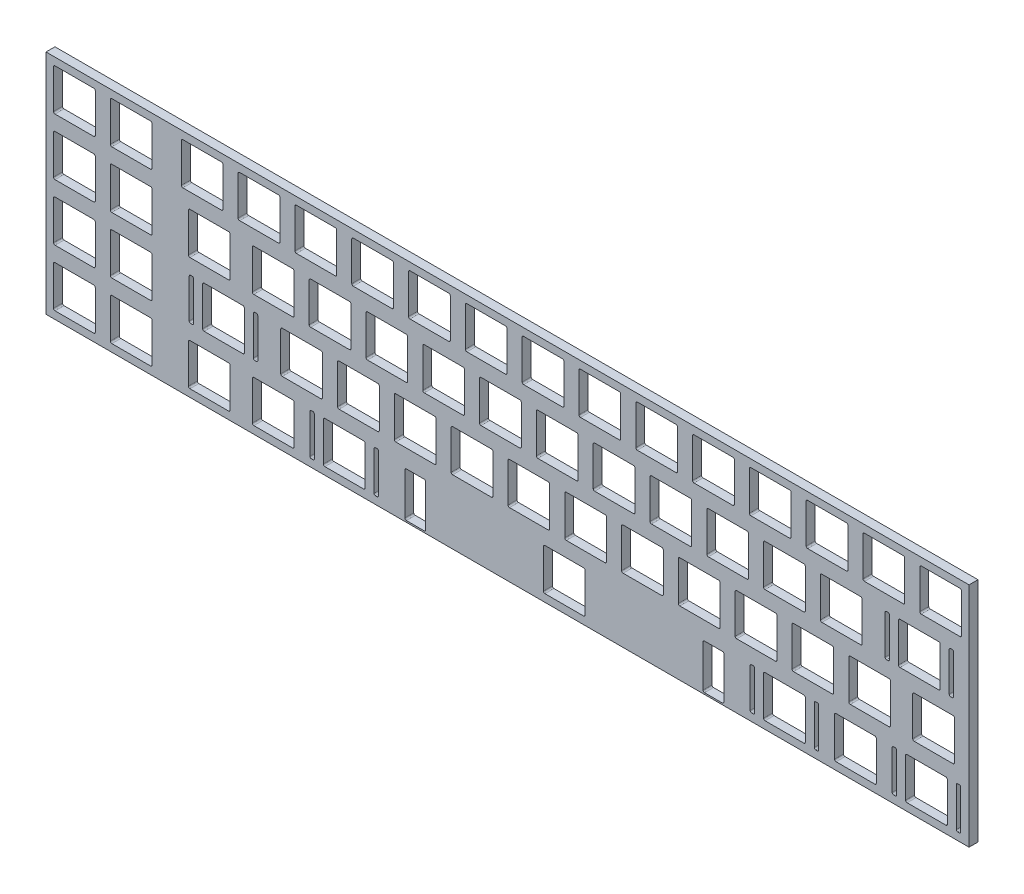
from build123d import *

# Parameters (mm, degrees)
MODEL_W             = 309.5625
MODEL_H             = 76.2
BOSS_EXTRUDE1_DEPTH = 3


with BuildPart() as part:
    # Model → Boss-Extrude1 (new body)
    with BuildSketch(Plane.XY):
        with Locations((154.78125, -38.1)):
            Rectangle(MODEL_W, MODEL_H)
        with BuildLine():
            Line((3.025, -2.525), (16.025, -2.525))
            ThreePointArc((16.025, -2.525), (16.378553391, -2.671446609), (16.525, -3.025))
            Line((16.525, -3.025), (16.525, -16.025))
            ThreePointArc((16.525, -16.025), (16.378553391, -16.378553391), (16.025, -16.525))
            Line((16.025, -16.525), (3.025, -16.525))
            ThreePointArc((3.025, -16.525), (2.671446609, -16.378553391), (2.525, -16.025))
            Line((2.525, -16.025), (2.525, -3.025))
            ThreePointArc((2.525, -3.025), (2.671446609, -2.671446609), (3.025, -2.525))
        make_face(mode=Mode.SUBTRACT)
        with BuildLine():
            Line((22.075, -2.525), (35.075, -2.525))
            ThreePointArc((35.075, -2.525), (35.428553391, -2.671446609), (35.575, -3.025))
            Line((35.575, -3.025), (35.575, -16.025))
            ThreePointArc((35.575, -16.025), (35.428553391, -16.378553391), (35.075, -16.525))
            Line((35.075, -16.525), (22.075, -16.525))
            ThreePointArc((22.075, -16.525), (21.721446609, -16.378553391), (21.575, -16.025))
            Line((21.575, -16.025), (21.575, -3.025))
            ThreePointArc((21.575, -3.025), (21.721446609, -2.671446609), (22.075, -2.525))
        make_face(mode=Mode.SUBTRACT)
        with BuildLine():
            Line((45.8875, -2.525), (58.8875, -2.525))
            ThreePointArc((58.8875, -2.525), (59.241053391, -2.671446609), (59.3875, -3.025))
            Line((59.3875, -3.025), (59.3875, -16.025))
            ThreePointArc((59.3875, -16.025), (59.241053391, -16.378553391), (58.8875, -16.525))
            Line((58.8875, -16.525), (45.8875, -16.525))
            ThreePointArc((45.8875, -16.525), (45.533946609, -16.378553391), (45.3875, -16.025))
            Line((45.3875, -16.025), (45.3875, -3.025))
            ThreePointArc((45.3875, -3.025), (45.533946609, -2.671446609), (45.8875, -2.525))
        make_face(mode=Mode.SUBTRACT)
        with BuildLine():
            Line((64.9375, -2.525), (77.9375, -2.525))
            ThreePointArc((77.9375, -2.525), (78.291053391, -2.671446609), (78.4375, -3.025))
            Line((78.4375, -3.025), (78.4375, -16.025))
            ThreePointArc((78.4375, -16.025), (78.291053391, -16.378553391), (77.9375, -16.525))
            Line((77.9375, -16.525), (64.9375, -16.525))
            ThreePointArc((64.9375, -16.525), (64.583946609, -16.378553391), (64.4375, -16.025))
            Line((64.4375, -16.025), (64.4375, -3.025))
            ThreePointArc((64.4375, -3.025), (64.583946609, -2.671446609), (64.9375, -2.525))
        make_face(mode=Mode.SUBTRACT)
        with BuildLine():
            Line((83.9875, -2.525), (96.9875, -2.525))
            ThreePointArc((96.9875, -2.525), (97.341053391, -2.671446609), (97.4875, -3.025))
            Line((97.4875, -3.025), (97.4875, -16.025))
            ThreePointArc((97.4875, -16.025), (97.341053391, -16.378553391), (96.9875, -16.525))
            Line((96.9875, -16.525), (83.9875, -16.525))
            ThreePointArc((83.9875, -16.525), (83.633946609, -16.378553391), (83.4875, -16.025))
            Line((83.4875, -16.025), (83.4875, -3.025))
            ThreePointArc((83.4875, -3.025), (83.633946609, -2.671446609), (83.9875, -2.525))
        make_face(mode=Mode.SUBTRACT)
        with BuildLine():
            Line((103.0375, -2.525), (116.0375, -2.525))
            ThreePointArc((116.0375, -2.525), (116.391053391, -2.671446609), (116.5375, -3.025))
            Line((116.5375, -3.025), (116.5375, -16.025))
            ThreePointArc((116.5375, -16.025), (116.391053391, -16.378553391), (116.0375, -16.525))
            Line((116.0375, -16.525), (103.0375, -16.525))
            ThreePointArc((103.0375, -16.525), (102.683946609, -16.378553391), (102.5375, -16.025))
            Line((102.5375, -16.025), (102.5375, -3.025))
            ThreePointArc((102.5375, -3.025), (102.683946609, -2.671446609), (103.0375, -2.525))
        make_face(mode=Mode.SUBTRACT)
        with BuildLine():
            Line((122.0875, -2.525), (135.0875, -2.525))
            ThreePointArc((135.0875, -2.525), (135.441053391, -2.671446609), (135.5875, -3.025))
            Line((135.5875, -3.025), (135.5875, -16.025))
            ThreePointArc((135.5875, -16.025), (135.441053391, -16.378553391), (135.0875, -16.525))
            Line((135.0875, -16.525), (122.0875, -16.525))
            ThreePointArc((122.0875, -16.525), (121.733946609, -16.378553391), (121.5875, -16.025))
            Line((121.5875, -16.025), (121.5875, -3.025))
            ThreePointArc((121.5875, -3.025), (121.733946609, -2.671446609), (122.0875, -2.525))
        make_face(mode=Mode.SUBTRACT)
        with BuildLine():
            Line((141.1375, -2.525), (154.1375, -2.525))
            ThreePointArc((154.1375, -2.525), (154.491053391, -2.671446609), (154.6375, -3.025))
            Line((154.6375, -3.025), (154.6375, -16.025))
            ThreePointArc((154.6375, -16.025), (154.491053391, -16.378553391), (154.1375, -16.525))
            Line((154.1375, -16.525), (141.1375, -16.525))
            ThreePointArc((141.1375, -16.525), (140.783946609, -16.378553391), (140.6375, -16.025))
            Line((140.6375, -16.025), (140.6375, -3.025))
            ThreePointArc((140.6375, -3.025), (140.783946609, -2.671446609), (141.1375, -2.525))
        make_face(mode=Mode.SUBTRACT)
        with BuildLine():
            Line((160.1875, -2.525), (173.1875, -2.525))
            ThreePointArc((173.1875, -2.525), (173.541053391, -2.671446609), (173.6875, -3.025))
            Line((173.6875, -3.025), (173.6875, -16.025))
            ThreePointArc((173.6875, -16.025), (173.541053391, -16.378553391), (173.1875, -16.525))
            Line((173.1875, -16.525), (160.1875, -16.525))
            ThreePointArc((160.1875, -16.525), (159.833946609, -16.378553391), (159.6875, -16.025))
            Line((159.6875, -16.025), (159.6875, -3.025))
            ThreePointArc((159.6875, -3.025), (159.833946609, -2.671446609), (160.1875, -2.525))
        make_face(mode=Mode.SUBTRACT)
        with BuildLine():
            Line((179.2375, -2.525), (192.2375, -2.525))
            ThreePointArc((192.2375, -2.525), (192.591053391, -2.671446609), (192.7375, -3.025))
            Line((192.7375, -3.025), (192.7375, -16.025))
            ThreePointArc((192.7375, -16.025), (192.591053391, -16.378553391), (192.2375, -16.525))
            Line((192.2375, -16.525), (179.2375, -16.525))
            ThreePointArc((179.2375, -16.525), (178.883946609, -16.378553391), (178.7375, -16.025))
            Line((178.7375, -16.025), (178.7375, -3.025))
            ThreePointArc((178.7375, -3.025), (178.883946609, -2.671446609), (179.2375, -2.525))
        make_face(mode=Mode.SUBTRACT)
        with BuildLine():
            Line((198.2875, -2.525), (211.2875, -2.525))
            ThreePointArc((211.2875, -2.525), (211.641053391, -2.671446609), (211.7875, -3.025))
            Line((211.7875, -3.025), (211.7875, -16.025))
            ThreePointArc((211.7875, -16.025), (211.641053391, -16.378553391), (211.2875, -16.525))
            Line((211.2875, -16.525), (198.2875, -16.525))
            ThreePointArc((198.2875, -16.525), (197.933946609, -16.378553391), (197.7875, -16.025))
            Line((197.7875, -16.025), (197.7875, -3.025))
            ThreePointArc((197.7875, -3.025), (197.933946609, -2.671446609), (198.2875, -2.525))
        make_face(mode=Mode.SUBTRACT)
        with BuildLine():
            Line((217.3375, -2.525), (230.3375, -2.525))
            ThreePointArc((230.3375, -2.525), (230.691053391, -2.671446609), (230.8375, -3.025))
            Line((230.8375, -3.025), (230.8375, -16.025))
            ThreePointArc((230.8375, -16.025), (230.691053391, -16.378553391), (230.3375, -16.525))
            Line((230.3375, -16.525), (217.3375, -16.525))
            ThreePointArc((217.3375, -16.525), (216.983946609, -16.378553391), (216.8375, -16.025))
            Line((216.8375, -16.025), (216.8375, -3.025))
            ThreePointArc((216.8375, -3.025), (216.983946609, -2.671446609), (217.3375, -2.525))
        make_face(mode=Mode.SUBTRACT)
        with BuildLine():
            Line((236.3875, -2.525), (249.3875, -2.525))
            ThreePointArc((249.3875, -2.525), (249.741053391, -2.671446609), (249.8875, -3.025))
            Line((249.8875, -3.025), (249.8875, -16.025))
            ThreePointArc((249.8875, -16.025), (249.741053391, -16.378553391), (249.3875, -16.525))
            Line((249.3875, -16.525), (236.3875, -16.525))
            ThreePointArc((236.3875, -16.525), (236.033946609, -16.378553391), (235.8875, -16.025))
            Line((235.8875, -16.025), (235.8875, -3.025))
            ThreePointArc((235.8875, -3.025), (236.033946609, -2.671446609), (236.3875, -2.525))
        make_face(mode=Mode.SUBTRACT)
        with BuildLine():
            Line((255.4375, -2.525), (268.4375, -2.525))
            ThreePointArc((268.4375, -2.525), (268.791053391, -2.671446609), (268.9375, -3.025))
            Line((268.9375, -3.025), (268.9375, -16.025))
            ThreePointArc((268.9375, -16.025), (268.791053391, -16.378553391), (268.4375, -16.525))
            Line((268.4375, -16.525), (255.4375, -16.525))
            ThreePointArc((255.4375, -16.525), (255.083946609, -16.378553391), (254.9375, -16.025))
            Line((254.9375, -16.025), (254.9375, -3.025))
            ThreePointArc((254.9375, -3.025), (255.083946609, -2.671446609), (255.4375, -2.525))
        make_face(mode=Mode.SUBTRACT)
        with BuildLine():
            Line((274.4875, -2.525), (287.4875, -2.525))
            ThreePointArc((287.4875, -2.525), (287.841053391, -2.671446609), (287.9875, -3.025))
            Line((287.9875, -3.025), (287.9875, -16.025))
            ThreePointArc((287.9875, -16.025), (287.841053391, -16.378553391), (287.4875, -16.525))
            Line((287.4875, -16.525), (274.4875, -16.525))
            ThreePointArc((274.4875, -16.525), (274.133946609, -16.378553391), (273.9875, -16.025))
            Line((273.9875, -16.025), (273.9875, -3.025))
            ThreePointArc((273.9875, -3.025), (274.133946609, -2.671446609), (274.4875, -2.525))
        make_face(mode=Mode.SUBTRACT)
        with BuildLine():
            Line((293.5375, -2.525), (306.5375, -2.525))
            ThreePointArc((306.5375, -2.525), (306.891053391, -2.671446609), (307.0375, -3.025))
            Line((307.0375, -3.025), (307.0375, -16.025))
            ThreePointArc((307.0375, -16.025), (306.891053391, -16.378553391), (306.5375, -16.525))
            Line((306.5375, -16.525), (293.5375, -16.525))
            ThreePointArc((293.5375, -16.525), (293.183946609, -16.378553391), (293.0375, -16.025))
            Line((293.0375, -16.025), (293.0375, -3.025))
            ThreePointArc((293.0375, -3.025), (293.183946609, -2.671446609), (293.5375, -2.525))
        make_face(mode=Mode.SUBTRACT)
        with BuildLine():
            Line((3.025, -21.575), (16.025, -21.575))
            ThreePointArc((16.025, -21.575), (16.378553391, -21.721446609), (16.525, -22.075))
            Line((16.525, -22.075), (16.525, -35.075))
            ThreePointArc((16.525, -35.075), (16.378553391, -35.428553391), (16.025, -35.575))
            Line((16.025, -35.575), (3.025, -35.575))
            ThreePointArc((3.025, -35.575), (2.671446609, -35.428553391), (2.525, -35.075))
            Line((2.525, -35.075), (2.525, -22.075))
            ThreePointArc((2.525, -22.075), (2.671446609, -21.721446609), (3.025, -21.575))
        make_face(mode=Mode.SUBTRACT)
        with BuildLine():
            Line((22.075, -21.575), (35.075, -21.575))
            ThreePointArc((35.075, -21.575), (35.428553391, -21.721446609), (35.575, -22.075))
            Line((35.575, -22.075), (35.575, -35.075))
            ThreePointArc((35.575, -35.075), (35.428553391, -35.428553391), (35.075, -35.575))
            Line((35.075, -35.575), (22.075, -35.575))
            ThreePointArc((22.075, -35.575), (21.721446609, -35.428553391), (21.575, -35.075))
            Line((21.575, -35.075), (21.575, -22.075))
            ThreePointArc((21.575, -22.075), (21.721446609, -21.721446609), (22.075, -21.575))
        make_face(mode=Mode.SUBTRACT)
        with BuildLine():
            Line((48.26875, -21.575), (61.26875, -21.575))
            ThreePointArc((61.26875, -21.575), (61.622303391, -21.721446609), (61.76875, -22.075))
            Line((61.76875, -22.075), (61.76875, -35.075))
            ThreePointArc((61.76875, -35.075), (61.622303391, -35.428553391), (61.26875, -35.575))
            Line((61.26875, -35.575), (48.26875, -35.575))
            ThreePointArc((48.26875, -35.575), (47.915196609, -35.428553391), (47.76875, -35.075))
            Line((47.76875, -35.075), (47.76875, -22.075))
            ThreePointArc((47.76875, -22.075), (47.915196609, -21.721446609), (48.26875, -21.575))
        make_face(mode=Mode.SUBTRACT)
        with BuildLine():
            Line((69.7, -21.575), (82.7, -21.575))
            ThreePointArc((82.7, -21.575), (83.053553391, -21.721446609), (83.2, -22.075))
            Line((83.2, -22.075), (83.2, -35.075))
            ThreePointArc((83.2, -35.075), (83.053553391, -35.428553391), (82.7, -35.575))
            Line((82.7, -35.575), (69.7, -35.575))
            ThreePointArc((69.7, -35.575), (69.346446609, -35.428553391), (69.2, -35.075))
            Line((69.2, -35.075), (69.2, -22.075))
            ThreePointArc((69.2, -22.075), (69.346446609, -21.721446609), (69.7, -21.575))
        make_face(mode=Mode.SUBTRACT)
        with BuildLine():
            Line((88.75, -21.575), (101.75, -21.575))
            ThreePointArc((101.75, -21.575), (102.103553391, -21.721446609), (102.25, -22.075))
            Line((102.25, -22.075), (102.25, -35.075))
            ThreePointArc((102.25, -35.075), (102.103553391, -35.428553391), (101.75, -35.575))
            Line((101.75, -35.575), (88.75, -35.575))
            ThreePointArc((88.75, -35.575), (88.396446609, -35.428553391), (88.25, -35.075))
            Line((88.25, -35.075), (88.25, -22.075))
            ThreePointArc((88.25, -22.075), (88.396446609, -21.721446609), (88.75, -21.575))
        make_face(mode=Mode.SUBTRACT)
        with BuildLine():
            Line((107.8, -21.575), (120.8, -21.575))
            ThreePointArc((120.8, -21.575), (121.153553391, -21.721446609), (121.3, -22.075))
            Line((121.3, -22.075), (121.3, -35.075))
            ThreePointArc((121.3, -35.075), (121.153553391, -35.428553391), (120.8, -35.575))
            Line((120.8, -35.575), (107.8, -35.575))
            ThreePointArc((107.8, -35.575), (107.446446609, -35.428553391), (107.3, -35.075))
            Line((107.3, -35.075), (107.3, -22.075))
            ThreePointArc((107.3, -22.075), (107.446446609, -21.721446609), (107.8, -21.575))
        make_face(mode=Mode.SUBTRACT)
        with BuildLine():
            Line((126.85, -21.575), (139.85, -21.575))
            ThreePointArc((139.85, -21.575), (140.203553391, -21.721446609), (140.35, -22.075))
            Line((140.35, -22.075), (140.35, -35.075))
            ThreePointArc((140.35, -35.075), (140.203553391, -35.428553391), (139.85, -35.575))
            Line((139.85, -35.575), (126.85, -35.575))
            ThreePointArc((126.85, -35.575), (126.496446609, -35.428553391), (126.35, -35.075))
            Line((126.35, -35.075), (126.35, -22.075))
            ThreePointArc((126.35, -22.075), (126.496446609, -21.721446609), (126.85, -21.575))
        make_face(mode=Mode.SUBTRACT)
        with BuildLine():
            Line((145.9, -21.575), (158.9, -21.575))
            ThreePointArc((158.9, -21.575), (159.253553391, -21.721446609), (159.4, -22.075))
            Line((159.4, -22.075), (159.4, -35.075))
            ThreePointArc((159.4, -35.075), (159.253553391, -35.428553391), (158.9, -35.575))
            Line((158.9, -35.575), (145.9, -35.575))
            ThreePointArc((145.9, -35.575), (145.546446609, -35.428553391), (145.4, -35.075))
            Line((145.4, -35.075), (145.4, -22.075))
            ThreePointArc((145.4, -22.075), (145.546446609, -21.721446609), (145.9, -21.575))
        make_face(mode=Mode.SUBTRACT)
        with BuildLine():
            Line((164.95, -21.575), (177.95, -21.575))
            ThreePointArc((177.95, -21.575), (178.303553391, -21.721446609), (178.45, -22.075))
            Line((178.45, -22.075), (178.45, -35.075))
            ThreePointArc((178.45, -35.075), (178.303553391, -35.428553391), (177.95, -35.575))
            Line((177.95, -35.575), (164.95, -35.575))
            ThreePointArc((164.95, -35.575), (164.596446609, -35.428553391), (164.45, -35.075))
            Line((164.45, -35.075), (164.45, -22.075))
            ThreePointArc((164.45, -22.075), (164.596446609, -21.721446609), (164.95, -21.575))
        make_face(mode=Mode.SUBTRACT)
        with BuildLine():
            Line((184, -21.575), (197, -21.575))
            ThreePointArc((197, -21.575), (197.353553391, -21.721446609), (197.5, -22.075))
            Line((197.5, -22.075), (197.5, -35.075))
            ThreePointArc((197.5, -35.075), (197.353553391, -35.428553391), (197, -35.575))
            Line((197, -35.575), (184, -35.575))
            ThreePointArc((184, -35.575), (183.646446609, -35.428553391), (183.5, -35.075))
            Line((183.5, -35.075), (183.5, -22.075))
            ThreePointArc((183.5, -22.075), (183.646446609, -21.721446609), (184, -21.575))
        make_face(mode=Mode.SUBTRACT)
        with BuildLine():
            Line((203.05, -21.575), (216.05, -21.575))
            ThreePointArc((216.05, -21.575), (216.403553391, -21.721446609), (216.55, -22.075))
            Line((216.55, -22.075), (216.55, -35.075))
            ThreePointArc((216.55, -35.075), (216.403553391, -35.428553391), (216.05, -35.575))
            Line((216.05, -35.575), (203.05, -35.575))
            ThreePointArc((203.05, -35.575), (202.696446609, -35.428553391), (202.55, -35.075))
            Line((202.55, -35.075), (202.55, -22.075))
            ThreePointArc((202.55, -22.075), (202.696446609, -21.721446609), (203.05, -21.575))
        make_face(mode=Mode.SUBTRACT)
        with BuildLine():
            Line((222.1, -21.575), (235.1, -21.575))
            ThreePointArc((235.1, -21.575), (235.453553391, -21.721446609), (235.6, -22.075))
            Line((235.6, -22.075), (235.6, -35.075))
            ThreePointArc((235.6, -35.075), (235.453553391, -35.428553391), (235.1, -35.575))
            Line((235.1, -35.575), (222.1, -35.575))
            ThreePointArc((222.1, -35.575), (221.746446609, -35.428553391), (221.6, -35.075))
            Line((221.6, -35.075), (221.6, -22.075))
            ThreePointArc((221.6, -22.075), (221.746446609, -21.721446609), (222.1, -21.575))
        make_face(mode=Mode.SUBTRACT)
        with BuildLine():
            Line((241.15, -21.575), (254.15, -21.575))
            ThreePointArc((254.15, -21.575), (254.503553391, -21.721446609), (254.65, -22.075))
            Line((254.65, -22.075), (254.65, -35.075))
            ThreePointArc((254.65, -35.075), (254.503553391, -35.428553391), (254.15, -35.575))
            Line((254.15, -35.575), (241.15, -35.575))
            ThreePointArc((241.15, -35.575), (240.796446609, -35.428553391), (240.65, -35.075))
            Line((240.65, -35.075), (240.65, -22.075))
            ThreePointArc((240.65, -22.075), (240.796446609, -21.721446609), (241.15, -21.575))
        make_face(mode=Mode.SUBTRACT)
        with BuildLine():
            Line((260.2, -21.575), (273.2, -21.575))
            ThreePointArc((273.2, -21.575), (273.553553391, -21.721446609), (273.7, -22.075))
            Line((273.7, -22.075), (273.7, -35.075))
            ThreePointArc((273.7, -35.075), (273.553553391, -35.428553391), (273.2, -35.575))
            Line((273.2, -35.575), (260.2, -35.575))
            ThreePointArc((260.2, -35.575), (259.846446609, -35.428553391), (259.7, -35.075))
            Line((259.7, -35.075), (259.7, -22.075))
            ThreePointArc((259.7, -22.075), (259.846446609, -21.721446609), (260.2, -21.575))
        make_face(mode=Mode.SUBTRACT)
        with BuildLine():
            Line((286.39375, -21.575), (299.39375, -21.575))
            ThreePointArc((299.39375, -21.575), (299.747303391, -21.721446609), (299.89375, -22.075))
            Line((299.89375, -22.075), (299.89375, -35.075))
            ThreePointArc((299.89375, -35.075), (299.747303391, -35.428553391), (299.39375, -35.575))
            Line((299.39375, -35.575), (286.39375, -35.575))
            ThreePointArc((286.39375, -35.575), (286.040196609, -35.428553391), (285.89375, -35.075))
            Line((285.89375, -35.075), (285.89375, -22.075))
            ThreePointArc((285.89375, -22.075), (286.040196609, -21.721446609), (286.39375, -21.575))
        make_face(mode=Mode.SUBTRACT)
        with BuildLine():
            Line((281.89375, -21.575), (282.39375, -21.575))
            ThreePointArc((282.39375, -21.575), (282.747303391, -21.721446609), (282.89375, -22.075))
            Line((282.89375, -22.075), (282.89375, -35.075))
            ThreePointArc((282.89375, -35.075), (282.747303391, -35.428553391), (282.39375, -35.575))
            Line((282.39375, -35.575), (281.89375, -35.575))
            ThreePointArc((281.89375, -35.575), (281.540196609, -35.428553391), (281.39375, -35.075))
            Line((281.39375, -35.075), (281.39375, -22.075))
            ThreePointArc((281.39375, -22.075), (281.540196609, -21.721446609), (281.89375, -21.575))
        make_face(mode=Mode.SUBTRACT)
        with BuildLine():
            Line((303.39375, -21.575), (303.89375, -21.575))
            ThreePointArc((303.89375, -21.575), (304.247303391, -21.721446609), (304.39375, -22.075))
            Line((304.39375, -22.075), (304.39375, -35.075))
            ThreePointArc((304.39375, -35.075), (304.247303391, -35.428553391), (303.89375, -35.575))
            Line((303.89375, -35.575), (303.39375, -35.575))
            ThreePointArc((303.39375, -35.575), (303.040196609, -35.428553391), (302.89375, -35.075))
            Line((302.89375, -35.075), (302.89375, -22.075))
            ThreePointArc((302.89375, -22.075), (303.040196609, -21.721446609), (303.39375, -21.575))
        make_face(mode=Mode.SUBTRACT)
        with BuildLine():
            Line((3.025, -40.625), (16.025, -40.625))
            ThreePointArc((16.025, -40.625), (16.378553391, -40.771446609), (16.525, -41.125))
            Line((16.525, -41.125), (16.525, -54.125))
            ThreePointArc((16.525, -54.125), (16.378553391, -54.478553391), (16.025, -54.625))
            Line((16.025, -54.625), (3.025, -54.625))
            ThreePointArc((3.025, -54.625), (2.671446609, -54.478553391), (2.525, -54.125))
            Line((2.525, -54.125), (2.525, -41.125))
            ThreePointArc((2.525, -41.125), (2.671446609, -40.771446609), (3.025, -40.625))
        make_face(mode=Mode.SUBTRACT)
        with BuildLine():
            Line((22.075, -40.625), (35.075, -40.625))
            ThreePointArc((35.075, -40.625), (35.428553391, -40.771446609), (35.575, -41.125))
            Line((35.575, -41.125), (35.575, -54.125))
            ThreePointArc((35.575, -54.125), (35.428553391, -54.478553391), (35.075, -54.625))
            Line((35.075, -54.625), (22.075, -54.625))
            ThreePointArc((22.075, -54.625), (21.721446609, -54.478553391), (21.575, -54.125))
            Line((21.575, -54.125), (21.575, -41.125))
            ThreePointArc((21.575, -41.125), (21.721446609, -40.771446609), (22.075, -40.625))
        make_face(mode=Mode.SUBTRACT)
        with BuildLine():
            Line((53.03125, -40.625), (66.03125, -40.625))
            ThreePointArc((66.03125, -40.625), (66.384803391, -40.771446609), (66.53125, -41.125))
            Line((66.53125, -41.125), (66.53125, -54.125))
            ThreePointArc((66.53125, -54.125), (66.384803391, -54.478553391), (66.03125, -54.625))
            Line((66.03125, -54.625), (53.03125, -54.625))
            ThreePointArc((53.03125, -54.625), (52.677696609, -54.478553391), (52.53125, -54.125))
            Line((52.53125, -54.125), (52.53125, -41.125))
            ThreePointArc((52.53125, -41.125), (52.677696609, -40.771446609), (53.03125, -40.625))
        make_face(mode=Mode.SUBTRACT)
        with BuildLine():
            Line((48.53125, -40.625), (49.03125, -40.625))
            ThreePointArc((49.03125, -40.625), (49.384803391, -40.771446609), (49.53125, -41.125))
            Line((49.53125, -41.125), (49.53125, -54.125))
            ThreePointArc((49.53125, -54.125), (49.384803391, -54.478553391), (49.03125, -54.625))
            Line((49.03125, -54.625), (48.53125, -54.625))
            ThreePointArc((48.53125, -54.625), (48.177696609, -54.478553391), (48.03125, -54.125))
            Line((48.03125, -54.125), (48.03125, -41.125))
            ThreePointArc((48.03125, -41.125), (48.177696609, -40.771446609), (48.53125, -40.625))
        make_face(mode=Mode.SUBTRACT)
        with BuildLine():
            Line((70.03125, -40.625), (70.53125, -40.625))
            ThreePointArc((70.53125, -40.625), (70.884803391, -40.771446609), (71.03125, -41.125))
            Line((71.03125, -41.125), (71.03125, -54.125))
            ThreePointArc((71.03125, -54.125), (70.884803391, -54.478553391), (70.53125, -54.625))
            Line((70.53125, -54.625), (70.03125, -54.625))
            ThreePointArc((70.03125, -54.625), (69.677696609, -54.478553391), (69.53125, -54.125))
            Line((69.53125, -54.125), (69.53125, -41.125))
            ThreePointArc((69.53125, -41.125), (69.677696609, -40.771446609), (70.03125, -40.625))
        make_face(mode=Mode.SUBTRACT)
        with BuildLine():
            Line((79.225, -40.625), (92.225, -40.625))
            ThreePointArc((92.225, -40.625), (92.578553391, -40.771446609), (92.725, -41.125))
            Line((92.725, -41.125), (92.725, -54.125))
            ThreePointArc((92.725, -54.125), (92.578553391, -54.478553391), (92.225, -54.625))
            Line((92.225, -54.625), (79.225, -54.625))
            ThreePointArc((79.225, -54.625), (78.871446609, -54.478553391), (78.725, -54.125))
            Line((78.725, -54.125), (78.725, -41.125))
            ThreePointArc((78.725, -41.125), (78.871446609, -40.771446609), (79.225, -40.625))
        make_face(mode=Mode.SUBTRACT)
        with BuildLine():
            Line((98.275, -40.625), (111.275, -40.625))
            ThreePointArc((111.275, -40.625), (111.628553391, -40.771446609), (111.775, -41.125))
            Line((111.775, -41.125), (111.775, -54.125))
            ThreePointArc((111.775, -54.125), (111.628553391, -54.478553391), (111.275, -54.625))
            Line((111.275, -54.625), (98.275, -54.625))
            ThreePointArc((98.275, -54.625), (97.921446609, -54.478553391), (97.775, -54.125))
            Line((97.775, -54.125), (97.775, -41.125))
            ThreePointArc((97.775, -41.125), (97.921446609, -40.771446609), (98.275, -40.625))
        make_face(mode=Mode.SUBTRACT)
        with BuildLine():
            Line((117.325, -40.625), (130.325, -40.625))
            ThreePointArc((130.325, -40.625), (130.678553391, -40.771446609), (130.825, -41.125))
            Line((130.825, -41.125), (130.825, -54.125))
            ThreePointArc((130.825, -54.125), (130.678553391, -54.478553391), (130.325, -54.625))
            Line((130.325, -54.625), (117.325, -54.625))
            ThreePointArc((117.325, -54.625), (116.971446609, -54.478553391), (116.825, -54.125))
            Line((116.825, -54.125), (116.825, -41.125))
            ThreePointArc((116.825, -41.125), (116.971446609, -40.771446609), (117.325, -40.625))
        make_face(mode=Mode.SUBTRACT)
        with BuildLine():
            Line((136.375, -40.625), (149.375, -40.625))
            ThreePointArc((149.375, -40.625), (149.728553391, -40.771446609), (149.875, -41.125))
            Line((149.875, -41.125), (149.875, -54.125))
            ThreePointArc((149.875, -54.125), (149.728553391, -54.478553391), (149.375, -54.625))
            Line((149.375, -54.625), (136.375, -54.625))
            ThreePointArc((136.375, -54.625), (136.021446609, -54.478553391), (135.875, -54.125))
            Line((135.875, -54.125), (135.875, -41.125))
            ThreePointArc((135.875, -41.125), (136.021446609, -40.771446609), (136.375, -40.625))
        make_face(mode=Mode.SUBTRACT)
        with BuildLine():
            Line((155.425, -40.625), (168.425, -40.625))
            ThreePointArc((168.425, -40.625), (168.778553391, -40.771446609), (168.925, -41.125))
            Line((168.925, -41.125), (168.925, -54.125))
            ThreePointArc((168.925, -54.125), (168.778553391, -54.478553391), (168.425, -54.625))
            Line((168.425, -54.625), (155.425, -54.625))
            ThreePointArc((155.425, -54.625), (155.071446609, -54.478553391), (154.925, -54.125))
            Line((154.925, -54.125), (154.925, -41.125))
            ThreePointArc((154.925, -41.125), (155.071446609, -40.771446609), (155.425, -40.625))
        make_face(mode=Mode.SUBTRACT)
        with BuildLine():
            Line((174.475, -40.625), (187.475, -40.625))
            ThreePointArc((187.475, -40.625), (187.828553391, -40.771446609), (187.975, -41.125))
            Line((187.975, -41.125), (187.975, -54.125))
            ThreePointArc((187.975, -54.125), (187.828553391, -54.478553391), (187.475, -54.625))
            Line((187.475, -54.625), (174.475, -54.625))
            ThreePointArc((174.475, -54.625), (174.121446609, -54.478553391), (173.975, -54.125))
            Line((173.975, -54.125), (173.975, -41.125))
            ThreePointArc((173.975, -41.125), (174.121446609, -40.771446609), (174.475, -40.625))
        make_face(mode=Mode.SUBTRACT)
        with BuildLine():
            Line((193.525, -40.625), (206.525, -40.625))
            ThreePointArc((206.525, -40.625), (206.878553391, -40.771446609), (207.025, -41.125))
            Line((207.025, -41.125), (207.025, -54.125))
            ThreePointArc((207.025, -54.125), (206.878553391, -54.478553391), (206.525, -54.625))
            Line((206.525, -54.625), (193.525, -54.625))
            ThreePointArc((193.525, -54.625), (193.171446609, -54.478553391), (193.025, -54.125))
            Line((193.025, -54.125), (193.025, -41.125))
            ThreePointArc((193.025, -41.125), (193.171446609, -40.771446609), (193.525, -40.625))
        make_face(mode=Mode.SUBTRACT)
        with BuildLine():
            Line((212.575, -40.625), (225.575, -40.625))
            ThreePointArc((225.575, -40.625), (225.928553391, -40.771446609), (226.075, -41.125))
            Line((226.075, -41.125), (226.075, -54.125))
            ThreePointArc((226.075, -54.125), (225.928553391, -54.478553391), (225.575, -54.625))
            Line((225.575, -54.625), (212.575, -54.625))
            ThreePointArc((212.575, -54.625), (212.221446609, -54.478553391), (212.075, -54.125))
            Line((212.075, -54.125), (212.075, -41.125))
            ThreePointArc((212.075, -41.125), (212.221446609, -40.771446609), (212.575, -40.625))
        make_face(mode=Mode.SUBTRACT)
        with BuildLine():
            Line((231.625, -40.625), (244.625, -40.625))
            ThreePointArc((244.625, -40.625), (244.978553391, -40.771446609), (245.125, -41.125))
            Line((245.125, -41.125), (245.125, -54.125))
            ThreePointArc((245.125, -54.125), (244.978553391, -54.478553391), (244.625, -54.625))
            Line((244.625, -54.625), (231.625, -54.625))
            ThreePointArc((231.625, -54.625), (231.271446609, -54.478553391), (231.125, -54.125))
            Line((231.125, -54.125), (231.125, -41.125))
            ThreePointArc((231.125, -41.125), (231.271446609, -40.771446609), (231.625, -40.625))
        make_face(mode=Mode.SUBTRACT)
        with BuildLine():
            Line((250.675, -40.625), (263.675, -40.625))
            ThreePointArc((263.675, -40.625), (264.028553391, -40.771446609), (264.175, -41.125))
            Line((264.175, -41.125), (264.175, -54.125))
            ThreePointArc((264.175, -54.125), (264.028553391, -54.478553391), (263.675, -54.625))
            Line((263.675, -54.625), (250.675, -54.625))
            ThreePointArc((250.675, -54.625), (250.321446609, -54.478553391), (250.175, -54.125))
            Line((250.175, -54.125), (250.175, -41.125))
            ThreePointArc((250.175, -41.125), (250.321446609, -40.771446609), (250.675, -40.625))
        make_face(mode=Mode.SUBTRACT)
        with BuildLine():
            Line((269.725, -40.625), (282.725, -40.625))
            ThreePointArc((282.725, -40.625), (283.078553391, -40.771446609), (283.225, -41.125))
            Line((283.225, -41.125), (283.225, -54.125))
            ThreePointArc((283.225, -54.125), (283.078553391, -54.478553391), (282.725, -54.625))
            Line((282.725, -54.625), (269.725, -54.625))
            ThreePointArc((269.725, -54.625), (269.371446609, -54.478553391), (269.225, -54.125))
            Line((269.225, -54.125), (269.225, -41.125))
            ThreePointArc((269.225, -41.125), (269.371446609, -40.771446609), (269.725, -40.625))
        make_face(mode=Mode.SUBTRACT)
        with BuildLine():
            Line((291.15625, -40.625), (304.15625, -40.625))
            ThreePointArc((304.15625, -40.625), (304.509803391, -40.771446609), (304.65625, -41.125))
            Line((304.65625, -41.125), (304.65625, -54.125))
            ThreePointArc((304.65625, -54.125), (304.509803391, -54.478553391), (304.15625, -54.625))
            Line((304.15625, -54.625), (291.15625, -54.625))
            ThreePointArc((291.15625, -54.625), (290.802696609, -54.478553391), (290.65625, -54.125))
            Line((290.65625, -54.125), (290.65625, -41.125))
            ThreePointArc((290.65625, -41.125), (290.802696609, -40.771446609), (291.15625, -40.625))
        make_face(mode=Mode.SUBTRACT)
        with BuildLine():
            Line((3.025, -59.675), (16.025, -59.675))
            ThreePointArc((16.025, -59.675), (16.378553391, -59.821446609), (16.525, -60.175))
            Line((16.525, -60.175), (16.525, -73.175))
            ThreePointArc((16.525, -73.175), (16.378553391, -73.528553391), (16.025, -73.675))
            Line((16.025, -73.675), (3.025, -73.675))
            ThreePointArc((3.025, -73.675), (2.671446609, -73.528553391), (2.525, -73.175))
            Line((2.525, -73.175), (2.525, -60.175))
            ThreePointArc((2.525, -60.175), (2.671446609, -59.821446609), (3.025, -59.675))
        make_face(mode=Mode.SUBTRACT)
        with BuildLine():
            Line((22.075, -59.675), (35.075, -59.675))
            ThreePointArc((35.075, -59.675), (35.428553391, -59.821446609), (35.575, -60.175))
            Line((35.575, -60.175), (35.575, -73.175))
            ThreePointArc((35.575, -73.175), (35.428553391, -73.528553391), (35.075, -73.675))
            Line((35.075, -73.675), (22.075, -73.675))
            ThreePointArc((22.075, -73.675), (21.721446609, -73.528553391), (21.575, -73.175))
            Line((21.575, -73.175), (21.575, -60.175))
            ThreePointArc((21.575, -60.175), (21.721446609, -59.821446609), (22.075, -59.675))
        make_face(mode=Mode.SUBTRACT)
        with BuildLine():
            Line((48.26875, -59.675), (61.26875, -59.675))
            ThreePointArc((61.26875, -59.675), (61.622303391, -59.821446609), (61.76875, -60.175))
            Line((61.76875, -60.175), (61.76875, -73.175))
            ThreePointArc((61.76875, -73.175), (61.622303391, -73.528553391), (61.26875, -73.675))
            Line((61.26875, -73.675), (48.26875, -73.675))
            ThreePointArc((48.26875, -73.675), (47.915196609, -73.528553391), (47.76875, -73.175))
            Line((47.76875, -73.175), (47.76875, -60.175))
            ThreePointArc((47.76875, -60.175), (47.915196609, -59.821446609), (48.26875, -59.675))
        make_face(mode=Mode.SUBTRACT)
        with BuildLine():
            Line((69.7, -59.675), (82.7, -59.675))
            ThreePointArc((82.7, -59.675), (83.053553391, -59.821446609), (83.2, -60.175))
            Line((83.2, -60.175), (83.2, -73.175))
            ThreePointArc((83.2, -73.175), (83.053553391, -73.528553391), (82.7, -73.675))
            Line((82.7, -73.675), (69.7, -73.675))
            ThreePointArc((69.7, -73.675), (69.346446609, -73.528553391), (69.2, -73.175))
            Line((69.2, -73.175), (69.2, -60.175))
            ThreePointArc((69.2, -60.175), (69.346446609, -59.821446609), (69.7, -59.675))
        make_face(mode=Mode.SUBTRACT)
        with BuildLine():
            Line((93.5125, -59.675), (106.5125, -59.675))
            ThreePointArc((106.5125, -59.675), (106.866053391, -59.821446609), (107.0125, -60.175))
            Line((107.0125, -60.175), (107.0125, -73.175))
            ThreePointArc((107.0125, -73.175), (106.866053391, -73.528553391), (106.5125, -73.675))
            Line((106.5125, -73.675), (93.5125, -73.675))
            ThreePointArc((93.5125, -73.675), (93.158946609, -73.528553391), (93.0125, -73.175))
            Line((93.0125, -73.175), (93.0125, -60.175))
            ThreePointArc((93.0125, -60.175), (93.158946609, -59.821446609), (93.5125, -59.675))
        make_face(mode=Mode.SUBTRACT)
        with BuildLine():
            Line((89.0125, -59.675), (89.5125, -59.675))
            ThreePointArc((89.5125, -59.675), (89.866053391, -59.821446609), (90.0125, -60.175))
            Line((90.0125, -60.175), (90.0125, -73.175))
            ThreePointArc((90.0125, -73.175), (89.866053391, -73.528553391), (89.5125, -73.675))
            Line((89.5125, -73.675), (89.0125, -73.675))
            ThreePointArc((89.0125, -73.675), (88.658946609, -73.528553391), (88.5125, -73.175))
            Line((88.5125, -73.175), (88.5125, -60.175))
            ThreePointArc((88.5125, -60.175), (88.658946609, -59.821446609), (89.0125, -59.675))
        make_face(mode=Mode.SUBTRACT)
        with BuildLine():
            Line((110.5125, -59.675), (111.0125, -59.675))
            ThreePointArc((111.0125, -59.675), (111.366053391, -59.821446609), (111.5125, -60.175))
            Line((111.5125, -60.175), (111.5125, -73.175))
            ThreePointArc((111.5125, -73.175), (111.366053391, -73.528553391), (111.0125, -73.675))
            Line((111.0125, -73.675), (110.5125, -73.675))
            ThreePointArc((110.5125, -73.675), (110.158946609, -73.528553391), (110.0125, -73.175))
            Line((110.0125, -73.175), (110.0125, -60.175))
            ThreePointArc((110.0125, -60.175), (110.158946609, -59.821446609), (110.5125, -59.675))
        make_face(mode=Mode.SUBTRACT)
        with BuildLine():
            Line((167.33125, -59.675), (180.33125, -59.675))
            ThreePointArc((180.33125, -59.675), (180.684803391, -59.821446609), (180.83125, -60.175))
            Line((180.83125, -60.175), (180.83125, -73.175))
            ThreePointArc((180.83125, -73.175), (180.684803391, -73.528553391), (180.33125, -73.675))
            Line((180.33125, -73.675), (167.33125, -73.675))
            ThreePointArc((167.33125, -73.675), (166.977696609, -73.528553391), (166.83125, -73.175))
            Line((166.83125, -73.175), (166.83125, -60.175))
            ThreePointArc((166.83125, -60.175), (166.977696609, -59.821446609), (167.33125, -59.675))
        make_face(mode=Mode.SUBTRACT)
        with BuildLine():
            Line((120.83125, -60.675), (126.83125, -60.675))
            ThreePointArc((126.83125, -60.675), (127.184803391, -60.821446609), (127.33125, -61.175))
            Line((127.33125, -61.175), (127.33125, -75.175))
            ThreePointArc((127.33125, -75.175), (127.184803391, -75.528553391), (126.83125, -75.675))
            Line((126.83125, -75.675), (120.83125, -75.675))
            ThreePointArc((120.83125, -75.675), (120.477696609, -75.528553391), (120.33125, -75.175))
            Line((120.33125, -75.175), (120.33125, -61.175))
            ThreePointArc((120.33125, -61.175), (120.477696609, -60.821446609), (120.83125, -60.675))
        make_face(mode=Mode.SUBTRACT)
        with BuildLine():
            Line((220.83125, -60.675), (226.83125, -60.675))
            ThreePointArc((226.83125, -60.675), (227.184803391, -60.821446609), (227.33125, -61.175))
            Line((227.33125, -61.175), (227.33125, -75.175))
            ThreePointArc((227.33125, -75.175), (227.184803391, -75.528553391), (226.83125, -75.675))
            Line((226.83125, -75.675), (220.83125, -75.675))
            ThreePointArc((220.83125, -75.675), (220.477696609, -75.528553391), (220.33125, -75.175))
            Line((220.33125, -75.175), (220.33125, -61.175))
            ThreePointArc((220.33125, -61.175), (220.477696609, -60.821446609), (220.83125, -60.675))
        make_face(mode=Mode.SUBTRACT)
        with BuildLine():
            Line((241.15, -59.675), (254.15, -59.675))
            ThreePointArc((254.15, -59.675), (254.503553391, -59.821446609), (254.65, -60.175))
            Line((254.65, -60.175), (254.65, -73.175))
            ThreePointArc((254.65, -73.175), (254.503553391, -73.528553391), (254.15, -73.675))
            Line((254.15, -73.675), (241.15, -73.675))
            ThreePointArc((241.15, -73.675), (240.796446609, -73.528553391), (240.65, -73.175))
            Line((240.65, -73.175), (240.65, -60.175))
            ThreePointArc((240.65, -60.175), (240.796446609, -59.821446609), (241.15, -59.675))
        make_face(mode=Mode.SUBTRACT)
        with BuildLine():
            Line((236.65, -59.675), (237.15, -59.675))
            ThreePointArc((237.15, -59.675), (237.503553391, -59.821446609), (237.65, -60.175))
            Line((237.65, -60.175), (237.65, -73.175))
            ThreePointArc((237.65, -73.175), (237.503553391, -73.528553391), (237.15, -73.675))
            Line((237.15, -73.675), (236.65, -73.675))
            ThreePointArc((236.65, -73.675), (236.296446609, -73.528553391), (236.15, -73.175))
            Line((236.15, -73.175), (236.15, -60.175))
            ThreePointArc((236.15, -60.175), (236.296446609, -59.821446609), (236.65, -59.675))
        make_face(mode=Mode.SUBTRACT)
        with BuildLine():
            Line((258.15, -59.675), (258.65, -59.675))
            ThreePointArc((258.65, -59.675), (259.003553391, -59.821446609), (259.15, -60.175))
            Line((259.15, -60.175), (259.15, -73.175))
            ThreePointArc((259.15, -73.175), (259.003553391, -73.528553391), (258.65, -73.675))
            Line((258.65, -73.675), (258.15, -73.675))
            ThreePointArc((258.15, -73.675), (257.796446609, -73.528553391), (257.65, -73.175))
            Line((257.65, -73.175), (257.65, -60.175))
            ThreePointArc((257.65, -60.175), (257.796446609, -59.821446609), (258.15, -59.675))
        make_face(mode=Mode.SUBTRACT)
        with BuildLine():
            Line((264.9625, -59.675), (277.9625, -59.675))
            ThreePointArc((277.9625, -59.675), (278.316053391, -59.821446609), (278.4625, -60.175))
            Line((278.4625, -60.175), (278.4625, -73.175))
            ThreePointArc((278.4625, -73.175), (278.316053391, -73.528553391), (277.9625, -73.675))
            Line((277.9625, -73.675), (264.9625, -73.675))
            ThreePointArc((264.9625, -73.675), (264.608946609, -73.528553391), (264.4625, -73.175))
            Line((264.4625, -73.175), (264.4625, -60.175))
            ThreePointArc((264.4625, -60.175), (264.608946609, -59.821446609), (264.9625, -59.675))
        make_face(mode=Mode.SUBTRACT)
        with BuildLine():
            Line((288.775, -59.675), (301.775, -59.675))
            ThreePointArc((301.775, -59.675), (302.128553391, -59.821446609), (302.275, -60.175))
            Line((302.275, -60.175), (302.275, -73.175))
            ThreePointArc((302.275, -73.175), (302.128553391, -73.528553391), (301.775, -73.675))
            Line((301.775, -73.675), (288.775, -73.675))
            ThreePointArc((288.775, -73.675), (288.421446609, -73.528553391), (288.275, -73.175))
            Line((288.275, -73.175), (288.275, -60.175))
            ThreePointArc((288.275, -60.175), (288.421446609, -59.821446609), (288.775, -59.675))
        make_face(mode=Mode.SUBTRACT)
        with BuildLine():
            Line((284.275, -59.675), (284.775, -59.675))
            ThreePointArc((284.775, -59.675), (285.128553391, -59.821446609), (285.275, -60.175))
            Line((285.275, -60.175), (285.275, -73.175))
            ThreePointArc((285.275, -73.175), (285.128553391, -73.528553391), (284.775, -73.675))
            Line((284.775, -73.675), (284.275, -73.675))
            ThreePointArc((284.275, -73.675), (283.921446609, -73.528553391), (283.775, -73.175))
            Line((283.775, -73.175), (283.775, -60.175))
            ThreePointArc((283.775, -60.175), (283.921446609, -59.821446609), (284.275, -59.675))
        make_face(mode=Mode.SUBTRACT)
        with BuildLine():
            Line((305.775, -59.675), (306.275, -59.675))
            ThreePointArc((306.275, -59.675), (306.628553391, -59.821446609), (306.775, -60.175))
            Line((306.775, -60.175), (306.775, -73.175))
            ThreePointArc((306.775, -73.175), (306.628553391, -73.528553391), (306.275, -73.675))
            Line((306.275, -73.675), (305.775, -73.675))
            ThreePointArc((305.775, -73.675), (305.421446609, -73.528553391), (305.275, -73.175))
            Line((305.275, -73.175), (305.275, -60.175))
            ThreePointArc((305.275, -60.175), (305.421446609, -59.821446609), (305.775, -59.675))
        make_face(mode=Mode.SUBTRACT)
    extrude(amount=BOSS_EXTRUDE1_DEPTH)


solid = part.part
